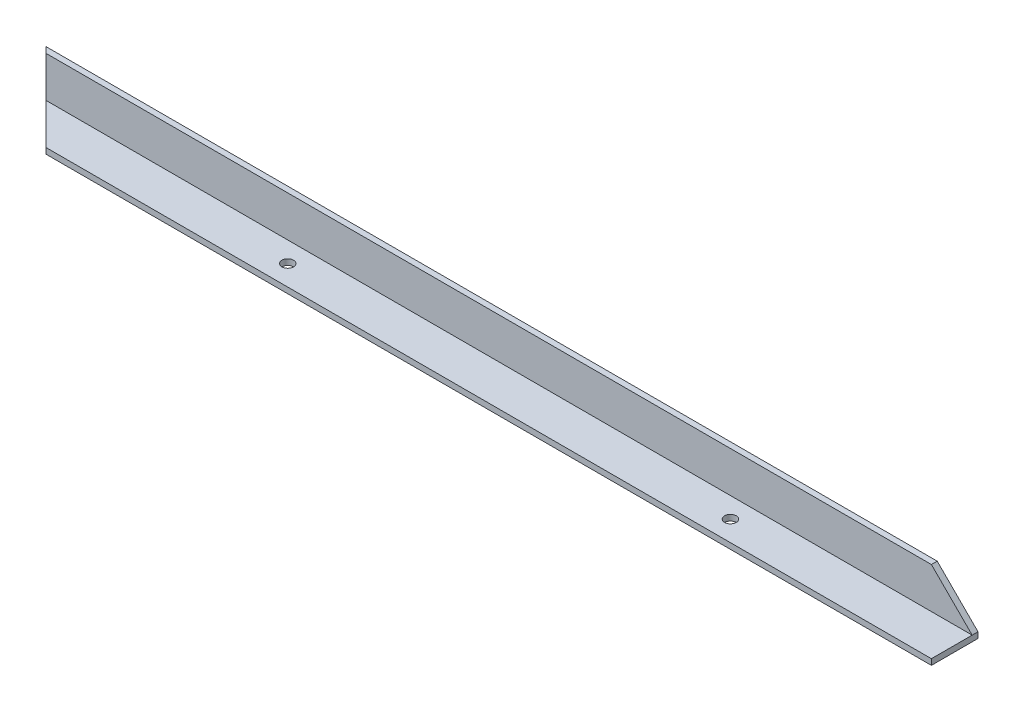
from build123d import *

# Parameters (mm, degrees)
SKETCH1_W           = 508
SKETCH1_H           = 25.4
BOSS_EXTRUDE1_DEPTH = 3.175
SKETCH2_W           = 508
SKETCH2_H           = 3.175
BOSS_EXTRUDE2_DEPTH = 22.225
CUT_EXTRUDE4_REACH  = 511.268
CUT_EXTRUDE5_DEPTH  = 22.225
SKETCH9_R           = 3.175
CUT_EXTRUDE6_DEPTH  = 3.175


with BuildPart() as part:
    # Sketch1 → Boss-Extrude1 (new body)
    with BuildSketch(Plane(origin=(0, 0, 0), x_dir=(1, 0, 0), z_dir=(0, 1, 0))):
        with Locations((-254, -12.7)):
            Rectangle(SKETCH1_W, SKETCH1_H)
    extrude(amount=BOSS_EXTRUDE1_DEPTH)

    # Sketch2 → Boss-Extrude2 (add)
    with BuildSketch(Plane(origin=(0, 3.175, 0), x_dir=(1, 0, 0), z_dir=(0, 1, 0))):
        with Locations((-254, -1.5875)):
            Rectangle(SKETCH2_W, SKETCH2_H)
    extrude(amount=BOSS_EXTRUDE2_DEPTH)

    # Cut-Extrude4: up to this face of the body (flat: up to its plane)
    cut_extrude4_end = Plane(part.part.faces().sort_by_distance((-254, 0, 12.7))[0])
    # Sketch7 → Cut-Extrude4 (cut, up to the picked face)
    with BuildSketch(Plane(origin=(0, 25.4, 0), x_dir=(1, 0, 0), z_dir=(0, 1, 0)), mode=Mode.PRIVATE) as cut_extrude4_sk1:
        Polygon((-508, 0), (-465.114238784, -42.885761216), (-525.028652123, -42.885761216), align=None)
    cut_extrude4_tool1 = split(extrude(cut_extrude4_sk1.sketch, amount=-CUT_EXTRUDE4_REACH, mode=Mode.PRIVATE), bisect_by=cut_extrude4_end, keep=Keep.BOTH, mode=Mode.PRIVATE)
    add(cut_extrude4_tool1.solids().sort_by(Axis((-499.380964, 25.4, 28.590507), (0, -1, 0)))[0], mode=Mode.SUBTRACT)

    # Sketch8 → Cut-Extrude5 (cut)
    with BuildSketch(Plane.XY.offset(3.175)):
        Polygon((0, 3.175), (-40.651364309, 43.826364309), (40.603016419, 27.12928401), align=None)
    extrude(amount=-CUT_EXTRUDE5_DEPTH, mode=Mode.SUBTRACT)

    # Sketch9 → Cut-Extrude6 (cut)
    with BuildSketch(Plane(origin=(0, 3.175, 0), x_dir=(1, 0, 0), z_dir=(0, 1, 0))):
        with Locations(Location((-361.95, -14.2875, 0), (0, 0, 270))):
            Circle(SKETCH9_R)
        with Locations(Location((-120.65, -14.2875, 0), (0, 0, 90))):
            Circle(SKETCH9_R)
    extrude(amount=-CUT_EXTRUDE6_DEPTH, mode=Mode.SUBTRACT)


solid = part.part
